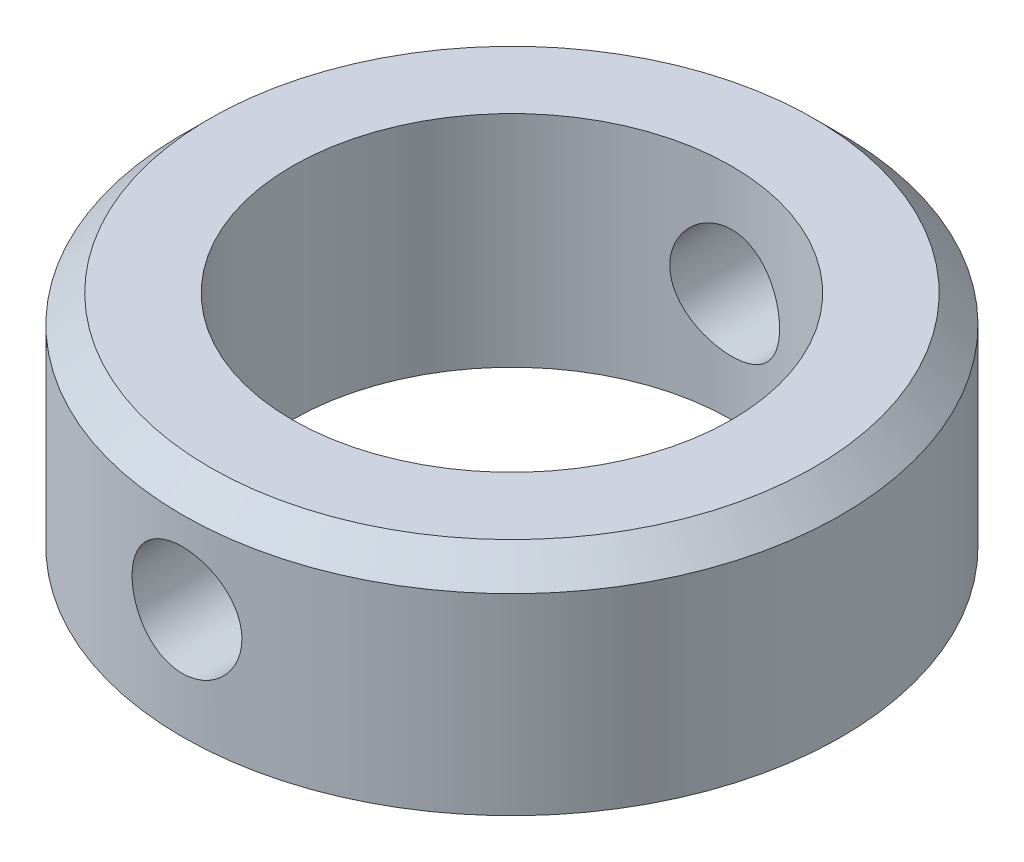
from build123d import *

# Parameters (mm, degrees)
SKETCH1_R               = 12
SKETCH1_R_2             = 8
BOSS_EXTRUDE1_DEPTH     = 4
CUT_EXTRUDE1_DEPTH      = 18.435595774
CUT_EXTRUDE1_DEPTH_BACK = 18.435595774
SKETCH2_R               = 2
CHAMFER1_SIZE           = 1


with BuildPart() as part:
    # Sketch1 → Boss-Extrude1 (new, symmetric)
    with BuildSketch(Plane(origin=(0, 0, 0), x_dir=(1, 0, 0), z_dir=(0, 1, 0))):
        with Locations(Location((0, 0, 0), (0, 0, 270))):
            Circle(SKETCH1_R)
        with Locations(Location((0, 0, 0), (0, 0, 270))):
            Circle(SKETCH1_R_2, mode=Mode.SUBTRACT)
    extrude(amount=BOSS_EXTRUDE1_DEPTH, both=True)

    # Sketch2 → Cut-Extrude1 (cut, two sides: drawn at the far end of the back side and taken through both)
    with BuildSketch(Plane.XY.offset(-CUT_EXTRUDE1_DEPTH_BACK)):
        Circle(SKETCH2_R)
    extrude(amount=CUT_EXTRUDE1_DEPTH + CUT_EXTRUDE1_DEPTH_BACK, mode=Mode.SUBTRACT)

    # Chamfer1
    chamfer1_edges = [part.edges().sort_by_distance(p)[0] for p in [
        (0, 4, -12),
    ]]
    chamfer(chamfer1_edges, length=CHAMFER1_SIZE)


solid = part.part
